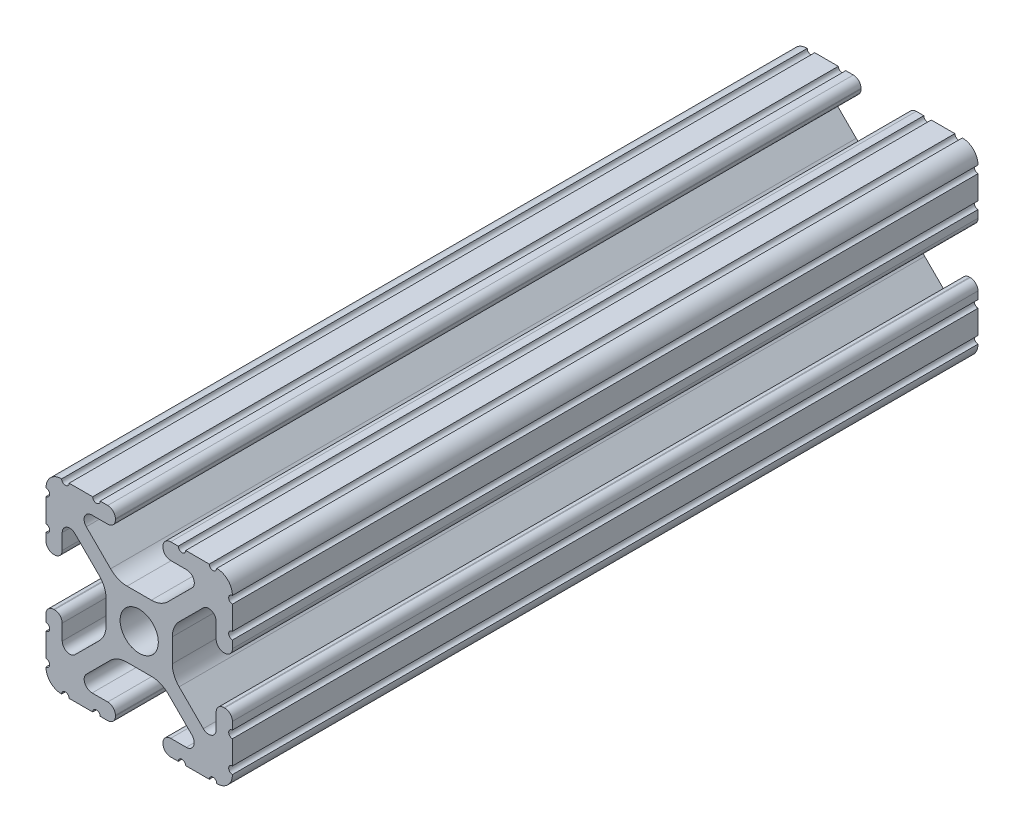
from build123d import *

# Parameters (mm, degrees)
SKETCH1_R           = 2.6035
BOSS_EXTRUDE1_DEPTH = 50.8


with BuildPart() as part:
    # Sketch1 → Boss-Extrude1 (new, symmetric)
    with BuildSketch(Plane.XY):
        with BuildLine():
            Line((-7.179650497, -8.645192506), (-3.952270251, -5.423690499))
            ThreePointArc((-3.952270251, -5.423690499), (-2.922936451, -4.736929036), (-1.709253557, -4.4958))
            Line((-1.709253557, -4.4958), (1.709253557, -4.4958))
            ThreePointArc((1.709253557, -4.4958), (2.922936451, -4.736929036), (3.952270251, -5.423690499))
            Line((3.952270251, -5.423690499), (7.179650497, -8.645192506))
            ThreePointArc((7.179650497, -8.645192506), (7.41473083, -9.822813117), (6.416408329, -10.4902))
            Line((6.416408329, -10.4902), (4.287512407, -10.4902))
            ThreePointArc((4.287512407, -10.4902), (3.54574862, -10.79744862), (3.2385, -11.539212407))
            Line((3.2385, -11.539212407), (3.2385, -11.650987593))
            ThreePointArc((3.2385, -11.650987593), (3.54574862, -12.39275138), (4.287512407, -12.7))
            Line((4.287512407, -12.7), (5.317126718, -12.7))
            ThreePointArc((5.317126718, -12.7), (5.825126718, -12.192), (6.333126718, -12.7))
            Line((6.333126718, -12.7), (9.550443118, -12.7))
            ThreePointArc((9.550443118, -12.7), (10.058366869, -12.192000006), (10.566443095, -12.699847501))
            ThreePointArc((10.566443095, -12.699847501), (12.082537762, -12.08250727), (12.699846982, -10.566399977))
            ThreePointArc((12.699846982, -10.566399977), (12.192000006, -10.058323491), (12.7, -9.5504))
            Line((12.7, -9.5504), (12.7, -6.3330836))
            ThreePointArc((12.7, -6.3330836), (12.192, -5.8250836), (12.7, -5.3170836))
            Line((12.7, -5.3170836), (12.7, -4.287469289))
            ThreePointArc((12.7, -4.287469289), (12.39275138, -3.545705502), (11.650987593, -3.238456882))
            Line((11.650987593, -3.238456882), (11.539212407, -3.238456882))
            ThreePointArc((11.539212407, -3.238456882), (10.79744862, -3.545705502), (10.4902, -4.287469289))
            Line((10.4902, -4.287469289), (10.4902, -6.402089023))
            ThreePointArc((10.4902, -6.402089023), (9.856505071, -7.351067942), (8.737131347, -7.129408934))
            Line((8.737131347, -7.129408934), (5.441005833, -3.840816462))
            ThreePointArc((5.441005833, -3.840816462), (4.750877967, -2.809883091), (4.5085, -1.593185507))
            Line((4.5085, -1.593185507), (4.5085, 1.593185507))
            ThreePointArc((4.5085, 1.593185507), (4.750877967, 2.809883091), (5.441005833, 3.840816462))
            Line((5.441005833, 3.840816462), (8.737131347, 7.129408934))
            ThreePointArc((8.737131347, 7.129408934), (9.856505071, 7.351067942), (10.4902, 6.402089023))
            Line((10.4902, 6.402089023), (10.4902, 4.287469289))
            ThreePointArc((10.4902, 4.287469289), (10.79744862, 3.545705502), (11.539212407, 3.238456882))
            Line((11.539212407, 3.238456882), (11.650987593, 3.238456882))
            ThreePointArc((11.650987593, 3.238456882), (12.39275138, 3.545705502), (12.7, 4.287469289))
            Line((12.7, 4.287469289), (12.7, 5.3170836))
            ThreePointArc((12.7, 5.3170836), (12.192, 5.8250836), (12.7, 6.3330836))
            Line((12.7, 6.3330836), (12.7, 9.5504))
            ThreePointArc((12.7, 9.5504), (12.192000006, 10.058323491), (12.699846982, 10.566399977))
            ThreePointArc((12.699846982, 10.566399977), (12.082537762, 12.08250727), (10.566443095, 12.699847501))
            ThreePointArc((10.566443095, 12.699847501), (10.058366869, 12.192000006), (9.550443118, 12.7))
            Line((9.550443118, 12.7), (6.333126718, 12.7))
            ThreePointArc((6.333126718, 12.7), (5.825126718, 12.192), (5.317126718, 12.7))
            Line((5.317126718, 12.7), (4.287512407, 12.7))
            ThreePointArc((4.287512407, 12.7), (3.54574862, 12.39275138), (3.2385, 11.650987593))
            Line((3.2385, 11.650987593), (3.2385, 11.539212407))
            ThreePointArc((3.2385, 11.539212407), (3.54574862, 10.79744862), (4.287512407, 10.4902))
            Line((4.287512407, 10.4902), (6.476788598, 10.4902))
            ThreePointArc((6.476788598, 10.4902), (7.432222385, 9.85140422), (7.207036008, 8.724370562))
            Line((7.207036008, 8.724370562), (3.898272566, 5.423169045))
            ThreePointArc((3.898272566, 5.423169045), (2.869120213, 4.736787962), (1.655778399, 4.4958))
            Line((1.655778399, 4.4958), (-1.655778399, 4.4958))
            ThreePointArc((-1.655778399, 4.4958), (-2.869120213, 4.736787962), (-3.898272566, 5.423169045))
            Line((-3.898272566, 5.423169045), (-7.207036008, 8.724370562))
            ThreePointArc((-7.207036008, 8.724370562), (-7.432222385, 9.85140422), (-6.476788598, 10.4902))
            Line((-6.476788598, 10.4902), (-4.287512407, 10.4902))
            ThreePointArc((-4.287512407, 10.4902), (-3.54574862, 10.79744862), (-3.2385, 11.539212407))
            Line((-3.2385, 11.539212407), (-3.2385, 11.650987593))
            ThreePointArc((-3.2385, 11.650987593), (-3.54574862, 12.39275138), (-4.287512407, 12.7))
            Line((-4.287512407, 12.7), (-5.317126718, 12.7))
            ThreePointArc((-5.317126718, 12.7), (-5.825126718, 12.192), (-6.333126718, 12.7))
            Line((-6.333126718, 12.7), (-9.550443118, 12.7))
            ThreePointArc((-9.550443118, 12.7), (-10.058366869, 12.192000006), (-10.566443095, 12.699847501))
            ThreePointArc((-10.566443095, 12.699847501), (-12.082537762, 12.08250727), (-12.699846982, 10.566399977))
            ThreePointArc((-12.699846982, 10.566399977), (-12.192000006, 10.058323491), (-12.7, 9.5504))
            Line((-12.7, 9.5504), (-12.7, 6.3330836))
            ThreePointArc((-12.7, 6.3330836), (-12.192, 5.8250836), (-12.7, 5.3170836))
            Line((-12.7, 5.3170836), (-12.7, 4.287469289))
            ThreePointArc((-12.7, 4.287469289), (-12.39275138, 3.545705502), (-11.650987593, 3.238456882))
            Line((-11.650987593, 3.238456882), (-11.539212407, 3.238456882))
            ThreePointArc((-11.539212407, 3.238456882), (-10.79744862, 3.545705502), (-10.4902, 4.287469289))
            Line((-10.4902, 4.287469289), (-10.4902, 6.402089023))
            ThreePointArc((-10.4902, 6.402089023), (-9.856505071, 7.351067942), (-8.737131347, 7.129408934))
            Line((-8.737131347, 7.129408934), (-5.441005833, 3.840816462))
            ThreePointArc((-5.441005833, 3.840816462), (-4.750877967, 2.809883091), (-4.5085, 1.593185507))
            Line((-4.5085, 1.593185507), (-4.5085, -1.593185507))
            ThreePointArc((-4.5085, -1.593185507), (-4.750877967, -2.809883091), (-5.441005833, -3.840816462))
            Line((-5.441005833, -3.840816462), (-8.737131347, -7.129408934))
            ThreePointArc((-8.737131347, -7.129408934), (-9.856505071, -7.351067942), (-10.4902, -6.402089023))
            Line((-10.4902, -6.402089023), (-10.4902, -4.287469289))
            ThreePointArc((-10.4902, -4.287469289), (-10.79744862, -3.545705502), (-11.539212407, -3.238456882))
            Line((-11.539212407, -3.238456882), (-11.650987593, -3.238456882))
            ThreePointArc((-11.650987593, -3.238456882), (-12.39275138, -3.545705502), (-12.7, -4.287469289))
            Line((-12.7, -4.287469289), (-12.7, -5.3170836))
            ThreePointArc((-12.7, -5.3170836), (-12.192, -5.8250836), (-12.7, -6.3330836))
            Line((-12.7, -6.3330836), (-12.7, -9.5504))
            ThreePointArc((-12.7, -9.5504), (-12.192000006, -10.058323491), (-12.699846982, -10.566399977))
            ThreePointArc((-12.699846982, -10.566399977), (-12.082537762, -12.08250727), (-10.566443095, -12.699847501))
            ThreePointArc((-10.566443095, -12.699847501), (-10.058366869, -12.192000006), (-9.550443118, -12.7))
            Line((-9.550443118, -12.7), (-6.333126718, -12.7))
            ThreePointArc((-6.333126718, -12.7), (-5.825126718, -12.192), (-5.317126718, -12.7))
            Line((-5.317126718, -12.7), (-4.287512407, -12.7))
            ThreePointArc((-4.287512407, -12.7), (-3.54574862, -12.39275138), (-3.2385, -11.650987593))
            Line((-3.2385, -11.650987593), (-3.2385, -11.539212407))
            ThreePointArc((-3.2385, -11.539212407), (-3.54574862, -10.79744862), (-4.287512407, -10.4902))
            Line((-4.287512407, -10.4902), (-6.416408329, -10.4902))
            ThreePointArc((-6.416408329, -10.4902), (-7.41473083, -9.822813117), (-7.179650497, -8.645192506))
        make_face()
        Circle(SKETCH1_R, mode=Mode.SUBTRACT)
    extrude(amount=BOSS_EXTRUDE1_DEPTH, both=True)


solid = part.part
